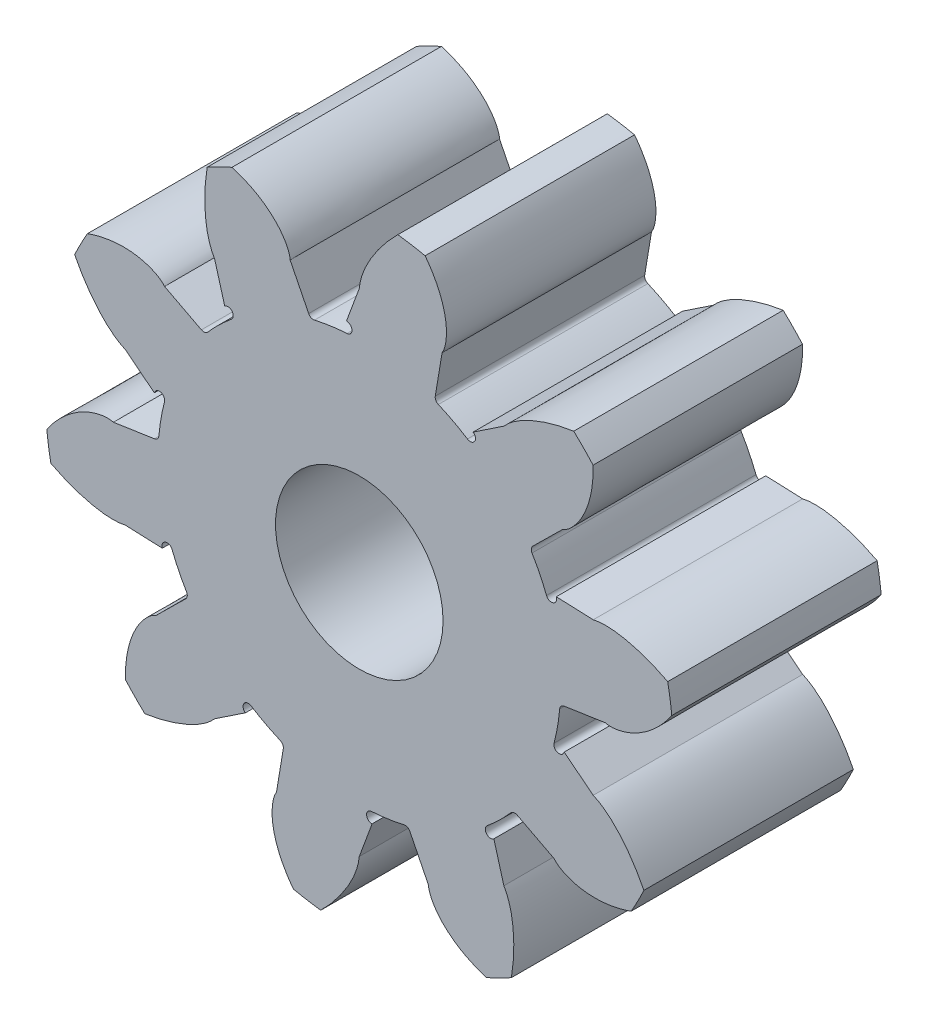
from build123d import *

# Parameters (mm, degrees)
CROQUIS2_R              = 2
SALIENTE_EXTRUIR1_DEPTH = 5
MATRIZC6_COUNT          = 10


with BuildPart() as part:
    # Croquis2 → Saliente-Extruir1 (new body)
    with BuildSketch(Plane.XY):
        with BuildLine():
            Line((-0.306026412, 5.044473868), (0, 5.87307888))
            add(Edge.make_bspline(
                [(0, 5.87307888), (0.02679779, 6.141175495), (0.274936867, 6.703868053), (0.663188036, 7.188067029), (0.910477928, 7.4337912), (0.9201705, 7.443338381)],
                knots=[0, 0, 0, 0, 0.049397205, 0.111126444, 0.113633344, 0.113633344, 0.113633344, 0.113633344], degree=3))
            ThreePointArc((0.9201705, 7.443338381), (1.246914914, 7.395620542), (1.571242221, 7.333566519))
            add(Edge.make_bspline(
                [(1.976598848, 5.530471275), (2.031114418, 5.617400913), (2.087789883, 5.844644836), (2.081168958, 6.255490925), (1.933755754, 6.776716333), (1.720527283, 7.138546833), (1.576032848, 7.327357984), (1.571242221, 7.333566519)],
                knots=[0, 0, 0, 0, 0.049397205, 0.111126444, 0.197545762, 0.30865546, 0.312445362, 0.312445362, 0.312445362, 0.312445362], degree=3))
            Line((1.976598848, 5.530471275), (1.814118887, 4.552477655))
            ThreePointArc((1.814118887, 4.552477655), (1.827796208, 4.471943871), (1.888292818, 4.417053803))
            ThreePointArc((1.888292818, 4.417053803), (-0.82041007, -4.733174556), (-0.291568658, 4.794893302))
            ThreePointArc((-0.291568658, 4.794893302), (-0.174364868, 4.926891746), (-0.306026412, 5.044473868))
        make_face()
        Circle(CROQUIS2_R, mode=Mode.SUBTRACT)
    saliente_extruir1 = extrude(amount=SALIENTE_EXTRUIR1_DEPTH)

    # MatrizC6: Saliente-Extruir1 ×10 about axis
    matrizc6_axis = Axis((0, 0, 5), (0, 0, -1))
    for i in range(1, MATRIZC6_COUNT):
        add(saliente_extruir1.rotate(matrizc6_axis, i * 360 / MATRIZC6_COUNT))


solid = part.part
